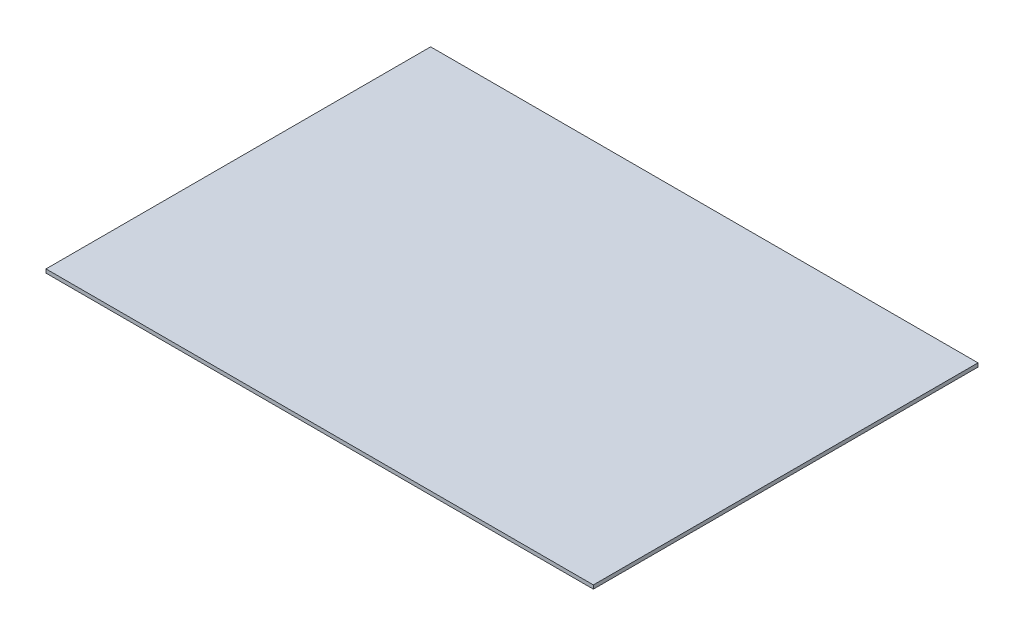
from build123d import *

# Parameters (mm, degrees)
SKETCH2_W           = 234.95
SKETCH2_H           = 165.1
BOSS_EXTRUDE1_DEPTH = 0.79375


with BuildPart() as part:
    # Sketch2 → Boss-Extrude1 (new, symmetric)
    with BuildSketch(Plane(origin=(0, 0, 0), x_dir=(1, 0, 0), z_dir=(0, 1, 0))):
        Rectangle(SKETCH2_W, SKETCH2_H)
    extrude(amount=BOSS_EXTRUDE1_DEPTH, both=True)


solid = part.part
